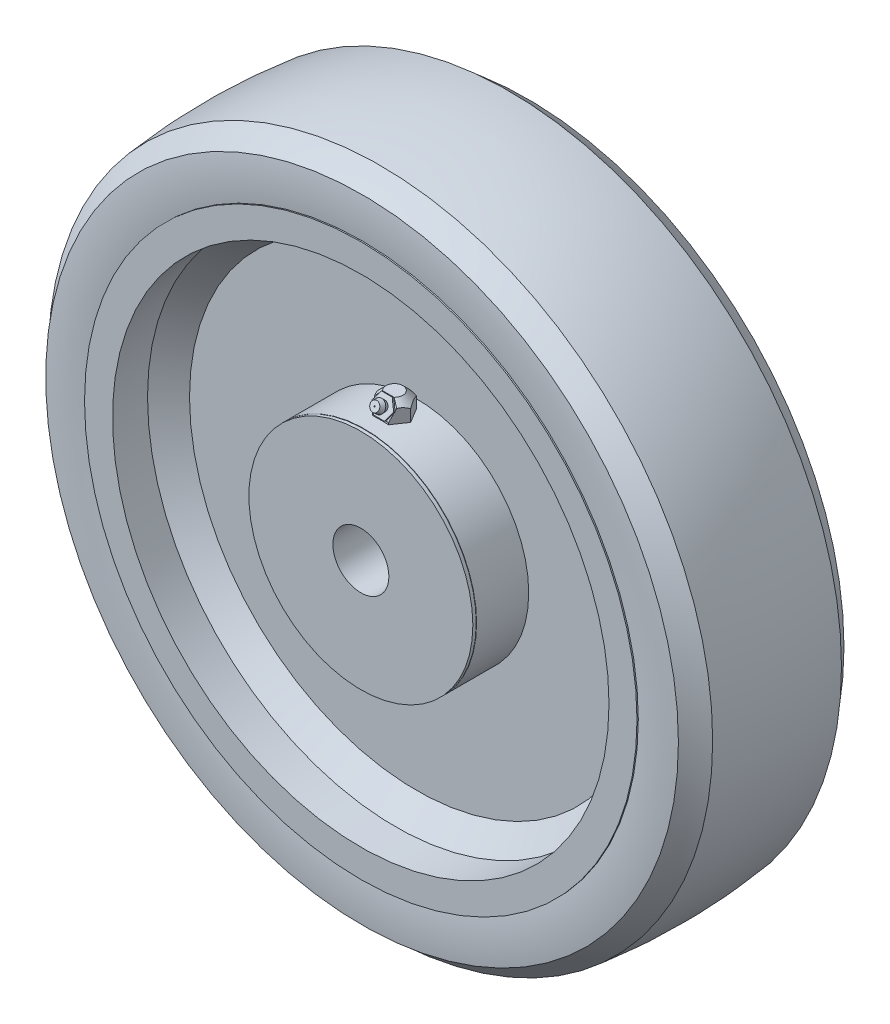
from build123d import *
from build123d.topology import SkipClean

# Parameters (mm, degrees)
CHAMFER1_SIZE           = 9.525
BOSS_EXTRUDE1_START     = 8.89
BOSS_EXTRUDE1_DEPTH     = 50.292
SKETCH10_R              = 12.7
CUT_EXTRUDE4_DEPTH      = 330.2
SKETCH6_OUTSIDE_W       = 923.41
SKETCH6_OUTSIDE_H       = 694.91
SKETCH6_OUTSIDE_R       = 3.81
CUT_EXTRUDE2_DEPTH      = 264.530070652
CUT_EXTRUDE2_DRAFT      = -45
CUT_EXTRUDE3_DEPTH      = 219.876484351
CUT_EXTRUDE3_DEPTH_BACK = 219.876484351
BOSS_EXTRUDE2_DEPTH     = 0.762


with BuildPart() as part:
    # Sketch2 → Revolve1 (revolve)
    with BuildSketch(Plane(origin=(0, 0, 0), x_dir=(0, 0, -1), z_dir=(1, 0, 0))):
        Polygon((0, 12.7), (-38.1, 12.7), (-38.1, 50.8), (-36.576, 50.8), (-36.576, 50.6222), (-36.3982, 50.6222), (-36.3982, 50.8), (-12.749644049, 50.8), (-12.749644049, 109.439834879), (-12.749644049, 112.614834879), (-38.149644049, 112.614834879), (-38.149644049, 125.314834879), (0, 125.314834879), align=None)
    revolve(axis=Axis((0, 0, 38.1), (0, 0, -1)))

    # Mirror1 2: part across plane


with BuildPart() as body_2:
    # Sketch3 → Revolve2 (revolve)
    with BuildSketch(Plane(origin=(0, 0, 0), x_dir=(0, 0, -1), z_dir=(1, 0, 0))):
        with BuildLine():
            Line((-37.554966734, 125.314834879), (0, 125.314834879))
            Line((0, 125.314834879), (0, 152.4))
            ThreePointArc((0, 152.4), (-14.629284684, 151.978358756), (-29.21, 150.714834879))
            ThreePointArc((-29.21, 150.714834879), (-33.284684366, 146.999142198), (-37.554966734, 143.51))
            ThreePointArc((-37.554966734, 143.51), (-38.1, 134.412417439), (-37.554966734, 125.314834879))
        make_face()
    revolve(axis=Axis((0, 0, 38.1), (0, 0, -1)))

    # Mirror1: body 2 across plane


with BuildPart() as body_2_1:
    add(body_2.part)
    add(body_2.part.mirror(Plane.XY))


with BuildPart() as part_1:
    add(part.part)
    add(part.part.mirror(Plane.XY))

    # Chamfer1
    chamfer1_edges = [part_1.edges().sort_by_distance(p)[0] for p in [
        (0, -112.614834879, 12.749644049),
        (0, -112.614834879, -12.749644049),
    ]]
    chamfer(chamfer1_edges, length=CHAMFER1_SIZE)


with BuildPart() as body_2_2:
    add(body_2_1.part)

    # Combine1: union part
    add(part_1.part)



with BuildPart() as body_2_2_1:
    # Sketch5 → Boss-Extrude1 (new body)
    with BuildSketch(Plane(origin=(0, 0, 0), x_dir=(1, 0, 0), z_dir=(0, 1, 0)).offset(BOSS_EXTRUDE1_START)):
        Polygon((7.332348419, -22.86), (3.666174209, -16.51), (-3.666174209, -16.51), (-7.332348419, -22.86), (-3.666174209, -29.21), (3.666174209, -29.21), align=None)
    extrude(amount=BOSS_EXTRUDE1_DEPTH)

    # Sketch10 → Cut-Extrude4 (cut)
    with BuildSketch(Plane.XY.offset(38.1)):
        Circle(SKETCH10_R)
    extrude(amount=-CUT_EXTRUDE4_DEPTH, mode=Mode.SUBTRACT)


with BuildPart() as cut_extrude2_tool:
    # Sketch6 outside → Cut-Extrude2 (with draft: the straight prism first)
    with BuildSketch(Plane(origin=(0, 59.182, 0), x_dir=(1, 0, 0), z_dir=(0, 1, 0))):
        Rectangle(SKETCH6_OUTSIDE_W, SKETCH6_OUTSIDE_H)
        with Locations((0, -22.86)):
            Circle(SKETCH6_OUTSIDE_R, mode=Mode.SUBTRACT)
    extrude(amount=-CUT_EXTRUDE2_DEPTH)
    # Cut-Extrude2: the draft: its side faces are tilted about the plane it starts from
    cut_extrude2_sides = [cut_extrude2_tool.faces().sort_by_distance(p)[0] for p in [
        (0, -73.083035326, 347.455),
        (461.705, -73.083035326, 0),
        (0, -73.083035326, -347.455),
        (-461.705, -73.083035326, 0),
        (-3.81, -73.083035326, 22.86),
    ]]
    draft(cut_extrude2_sides, Plane(origin=(0, 59.182, 0), x_dir=(1, 0, 0), z_dir=(0, 1, 0)), CUT_EXTRUDE2_DRAFT)


with BuildPart() as body_2_2_2:
    add(body_2_2_1.part)

    # Cut-Extrude2: cut by cut_extrude2_tool
    add(cut_extrude2_tool.part, mode=Mode.SUBTRACT)

    # Sketch7 → Cut-Extrude3 (cut, two sides: drawn at the far end of the back side and taken through both)
    with BuildSketch(Plane(origin=(0, 0, 0), x_dir=(0, 0, -1), z_dir=(1, 0, 0)).offset(-CUT_EXTRUDE3_DEPTH_BACK)):
        Polygon((-25.4, 59.69), (-29.545475081, 50.8), (-33.02, 50.8), (-33.02, 59.69), align=None)
    extrude(amount=CUT_EXTRUDE3_DEPTH + CUT_EXTRUDE3_DEPTH_BACK, mode=Mode.SUBTRACT)


with BuildPart() as body_2_3:
    with SkipClean():  # the faces are left unmerged after this step: merging them gives an invalid solid
        add(body_2_2.part)

        add(body_2_2_2.part)  # Boss-Extrude2 merges body 2 2
        # Sketch8 → Boss-Extrude2 (add)
        with BuildSketch(Plane(origin=(0, 20.389768217, 43.725999048), x_dir=(1, 0, 0), z_dir=(0, 0.4226182617407031, 0.9063077870366484))):
            Polygon((2.440665139, 34.347779928), (4.881330277, 38.575135953), (2.440665139, 42.802491977), (-2.440665139, 42.802491977), (-4.881330277, 38.575135953), (-2.440665139, 34.347779928), align=None)
        extrude(amount=BOSS_EXTRUDE2_DEPTH)

    # Sketch9 → Revolve3 (revolve)
    with SkipClean():  # the faces are left unmerged after this step: merging them gives an invalid solid
        with BuildSketch(Plane(origin=(0, 0, 0), x_dir=(0, 0, -1), z_dir=(1, 0, 0))):
            Polygon((-27.220769751, 57.588392274), (-28.65976959, 59.010061177), (-30.904004598, 59.305912889), (-31.689938487, 57.620472225), (-31.459736309, 57.513127187), (-31.567081348, 57.282925009), (-28.114048679, 55.672749432), align=None)
        revolve(axis=Axis((0, 55.672749432, 28.114048679), (0, -0.4226182617407024, -0.9063077870366486)))


solid = body_2_3.part
